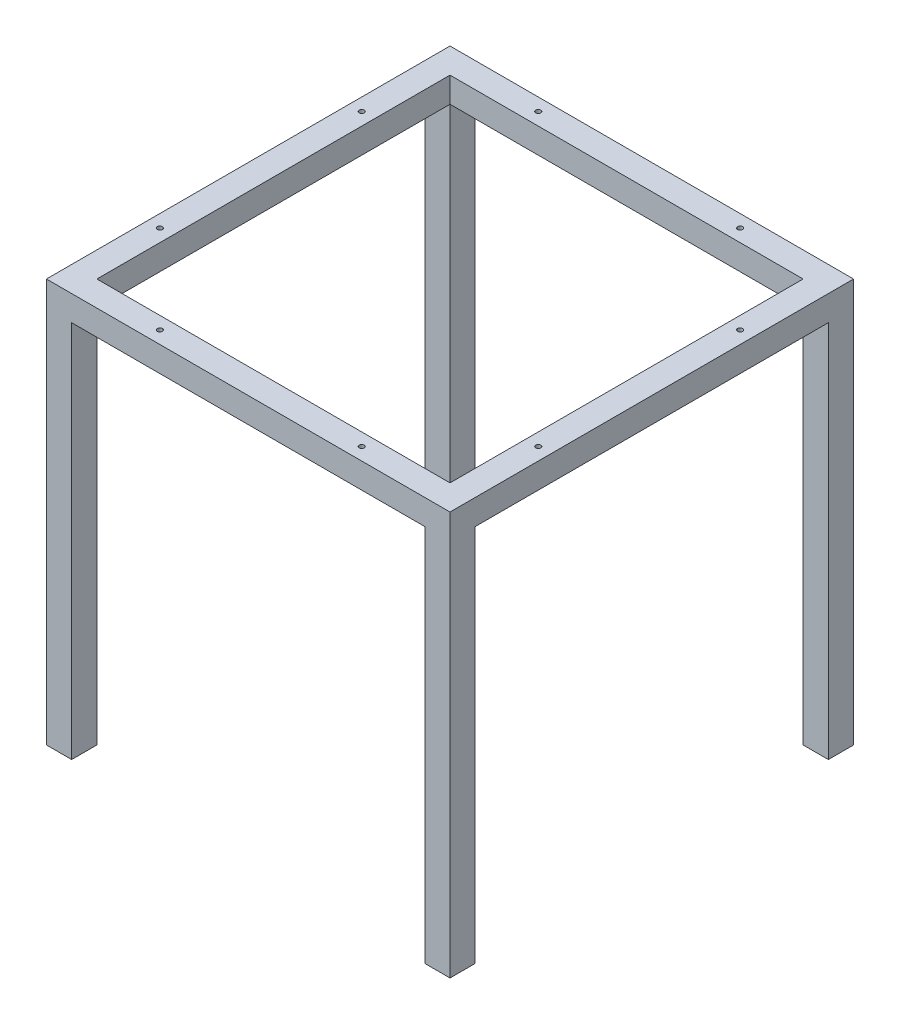
from build123d import *

# Parameters (mm, degrees)
SKETCH1_W               = 800
SKETCH1_H               = 800
SKETCH1_W_2             = 700
SKETCH1_H_2             = 700
BOSS_EXTRUDE1_DEPTH     = 50
SKETCH2_W               = 50
SKETCH2_H               = 50
BOSS_EXTRUDE2_DEPTH     = 800
CUT_EXTRUDE1_DEPTH      = 980.795897113
CUT_EXTRUDE1_DEPTH_BACK = 980.795897113
SKETCH3_R               = 5


with BuildPart() as part:
    # Sketch1 → Boss-Extrude1 (new body)
    with BuildSketch(Plane(origin=(0, 0, 0), x_dir=(1, 0, 0), z_dir=(0, 1, 0))):
        Rectangle(SKETCH1_W, SKETCH1_H)
        Rectangle(SKETCH1_W_2, SKETCH1_H_2, mode=Mode.SUBTRACT)
    extrude(amount=BOSS_EXTRUDE1_DEPTH)

    # Sketch2 → Boss-Extrude2 (add)
    with BuildSketch(Plane.XZ.offset(-50)):
        with Locations((-375, 375)):
            Rectangle(SKETCH2_W, SKETCH2_H)
        with Locations((375, 375)):
            Rectangle(SKETCH2_W, SKETCH2_H)
        with Locations((375, -375)):
            Rectangle(SKETCH2_W, SKETCH2_H)
        with Locations((-375, -375)):
            Rectangle(SKETCH2_W, SKETCH2_H)
    extrude(amount=BOSS_EXTRUDE2_DEPTH)

    # Sketch3 → Cut-Extrude1 (cut, two sides: drawn at the far end of the back side and taken through both)
    with BuildSketch(Plane(origin=(0, 50, 0), x_dir=(1, 0, 0), z_dir=(0, 1, 0)).offset(-CUT_EXTRUDE1_DEPTH_BACK)):
        with Locations(Location((-200, 375, 0), (0, 0, 90))):
            Circle(SKETCH3_R)
        with Locations(Location((-375, 200, 0), (0, 0, 90))):
            Circle(SKETCH3_R)
        with Locations(Location((-375, -200, 0), (0, 0, 90))):
            Circle(SKETCH3_R)
        with Locations(Location((-200, -375, 0), (0, 0, 90))):
            Circle(SKETCH3_R)
        with Locations(Location((200, -375, 0), (0, 0, 90))):
            Circle(SKETCH3_R)
        with Locations(Location((375, -200, 0), (0, 0, 90))):
            Circle(SKETCH3_R)
        with Locations(Location((375, 200, 0), (0, 0, 90))):
            Circle(SKETCH3_R)
        with Locations(Location((200, 375, 0), (0, 0, 90))):
            Circle(SKETCH3_R)
    extrude(amount=CUT_EXTRUDE1_DEPTH + CUT_EXTRUDE1_DEPTH_BACK, mode=Mode.SUBTRACT)


solid = part.part
